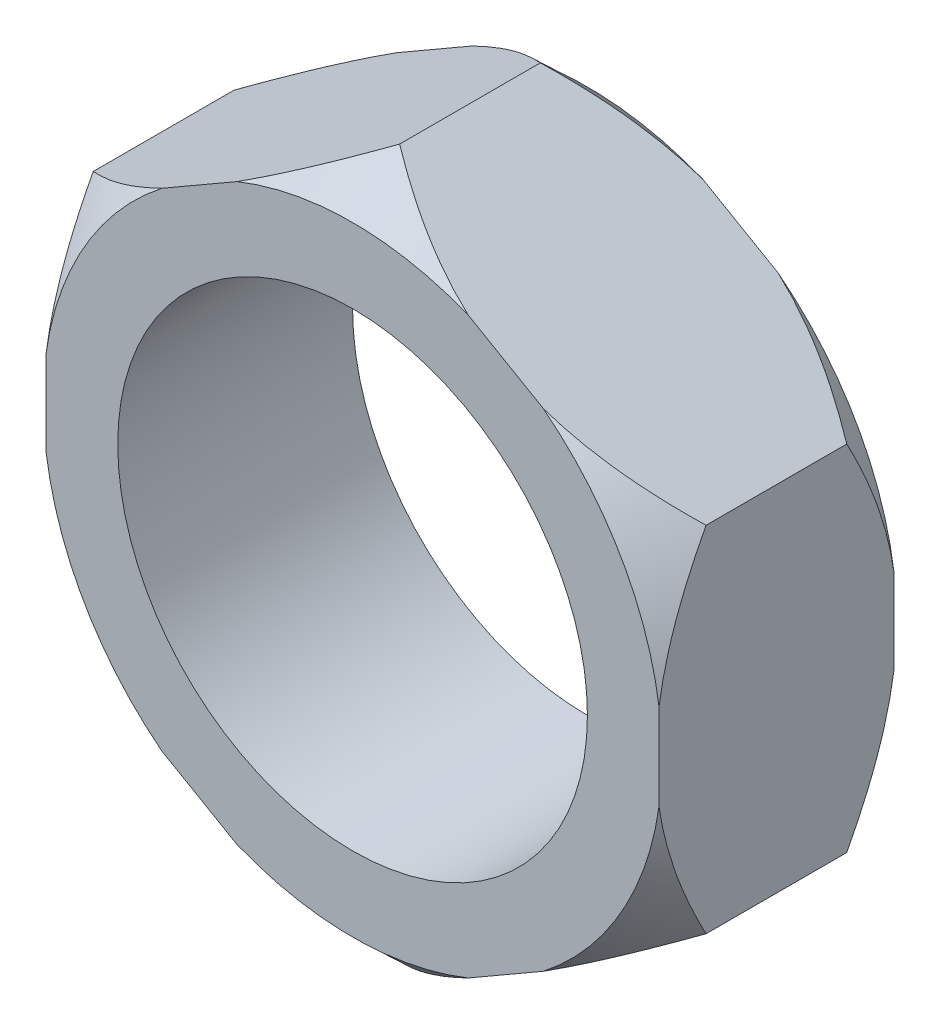
from build123d import *

# Parameters (mm, degrees)
SKETCH_1_R      = 1.5
EXTRUDE_1_DEPTH = 1.5


with BuildPart() as part:
    # 草图1 → 凸台-拉伸1 (new body)
    with BuildSketch(Plane.XY):
        Polygon((0, 2.259998291), (-1.957215932, 1.129999145), (-1.957215932, -1.129999145), (0, -2.259998291), (1.957215932, -1.129999145), (1.957215932, 1.129999145), align=None)
        Circle(SKETCH_1_R, mode=Mode.SUBTRACT)
    extrude(amount=EXTRUDE_1_DEPTH)

    # 草图2 → 切除-旋转1 (revolve, cut)
    with BuildSketch(Plane(origin=(0, 0, 0), x_dir=(0, 0, -1), z_dir=(1, 0, 0))):
        Polygon((-1.199430382, 2.259998291), (-1.569433195, 1.91124689), (-1.569433195, 2.384862388), (-1.189718912, 2.384862388), align=None)
    cut_revolve_1 = revolve(axis=Axis((0, 0, 1.5), (0, 0, -1)), mode=Mode.SUBTRACT)

    # 镜向1: 切除-旋转1 across plane
    add(cut_revolve_1.mirror(Plane(origin=(0, 0, 0.75), x_dir=(1, 0, 0), z_dir=(0, 0, -1))), mode=Mode.SUBTRACT)


solid = part.part
